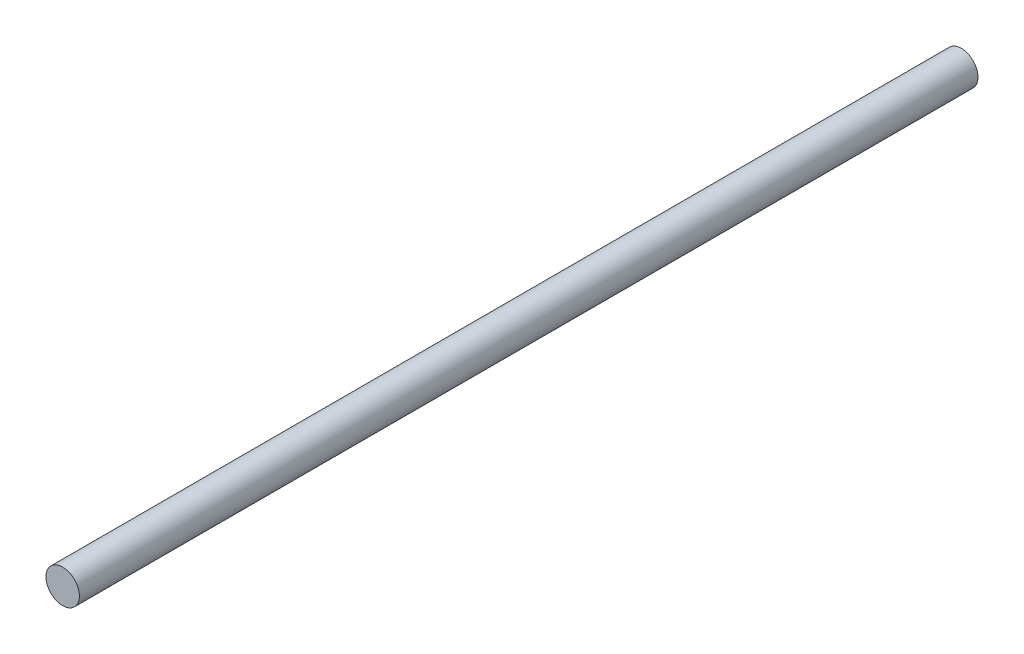
from build123d import *

# Parameters (mm, degrees)
SKETCH_1_R      = 4
EXTRUDE_1_DEPTH = 215


with BuildPart() as part:
    # 草图1 → 凸台-拉伸1 (new body)
    with BuildSketch(Plane.XY):
        Circle(SKETCH_1_R)
    extrude(amount=EXTRUDE_1_DEPTH)


solid = part.part
